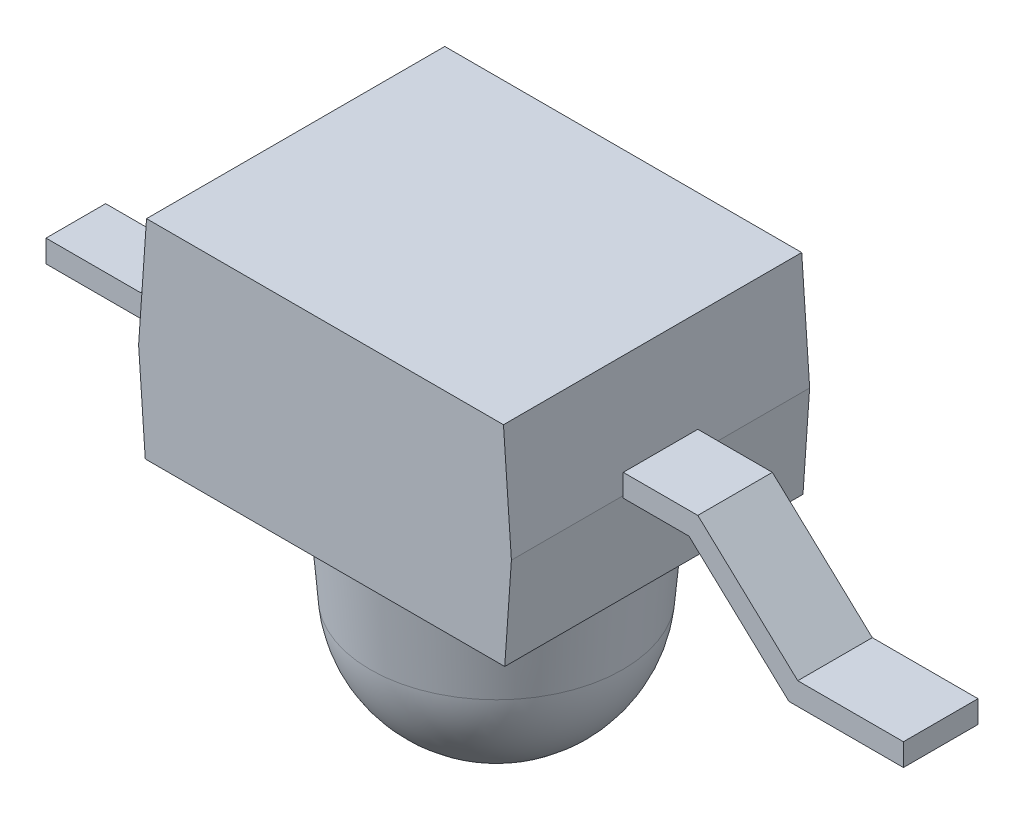
from build123d import *

# Parameters (mm, degrees)
EXTRUDE1_DEPTH = 1
EXTRUDE2_DEPTH = 0.25
EXTRUDE3_DEPTH = 0.2


with BuildPart() as part:
    # Sketch1 → Extrude1 (new, symmetric)
    with BuildSketch(Plane.XY):
        Polygon((1.196855623, 0.7), (-1.196855623, 0.7), (-1.25, -0.06), (-1.20524684, -0.7), (1.20524684, -0.7), (1.25, -0.06), align=None)
    extrude(amount=EXTRUDE1_DEPTH, both=True)

    # Sketch1<6> → Revolve1 (revolve)
    with BuildSketch(Plane.XY):
        with BuildLine():
            Line((1.05, -0.7), (0.15, -0.7))
            Line((0.15, -0.7), (0.15, -2.1))
            ThreePointArc((0.15, -2.1), (0.724932924, -1.876060806), (0.996924635, -1.322240312))
            Line((0.996924635, -1.322240312), (1.05, -0.7))
        make_face()
    revolve(axis=Axis((0.15, -0.7, 0), (0, -1, 0)))


with BuildPart() as body_2:
    # Sketch1<3> → Extrude2 (new, symmetric)
    with BuildSketch(Plane.XY):
        Polygon((1.75, 0.075), (1.25, 0.075), (1.25, -0.075), (1.690913429, -0.075), (2.361143872, -0.7), (3.129003177, -0.7), (3.129003177, -0.55), (2.420230444, -0.55), align=None)
    extrude(amount=EXTRUDE2_DEPTH, both=True)


with BuildPart() as body_3:
    # Sketch1<5> → Extrude3 (new, symmetric)
    with BuildSketch(Plane.XY):
        Polygon((-1.25, 0.075), (-1.366855623, 0.075), (-2.037086067, -0.55), (-2.670996823, -0.55), (-2.670996823, -0.7), (-1.977999495, -0.7), (-1.307769052, -0.075), (-1.25, -0.075), align=None)
    extrude(amount=EXTRUDE3_DEPTH, both=True)


solid = Compound([part.part, body_2.part, body_3.part])
